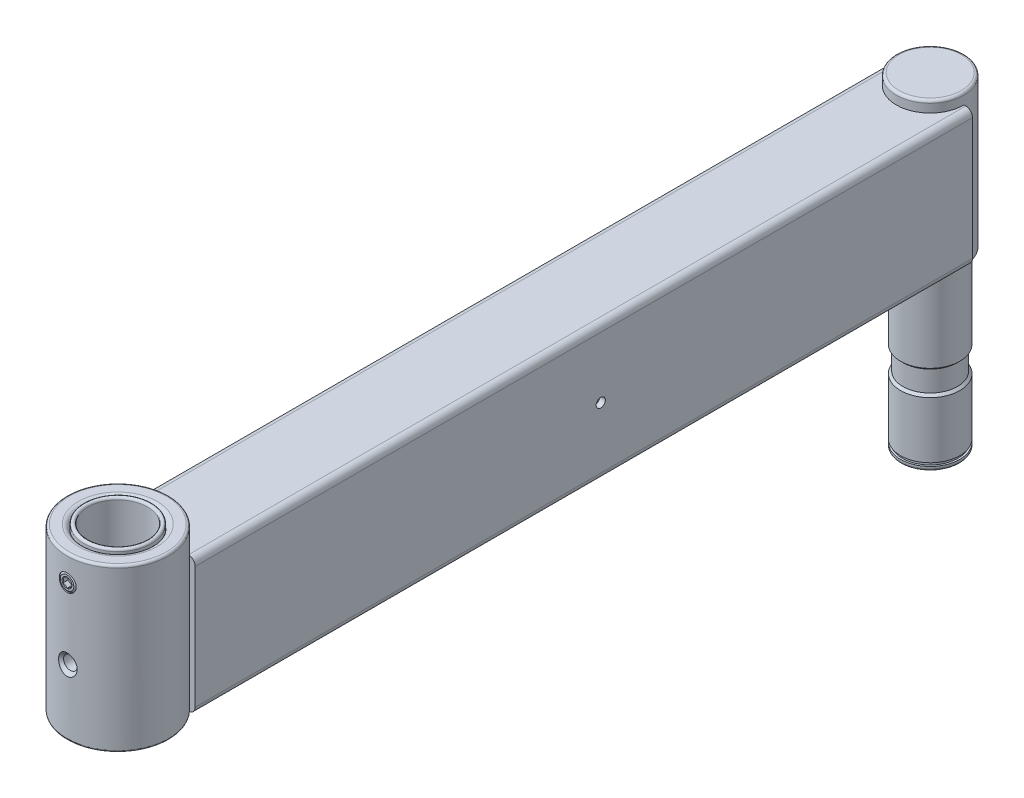
from build123d import *

# Parameters (mm, degrees)
BOSS_EXTRUDE1_DEPTH = 291.6428
SKETCH3_R           = 19.05
CUT_EXTRUDE1_DEPTH  = 300.588207448
CUT_EXTRUDE2_REACH  = 301.588
SKETCH4_R           = 3.175
SKETCH7_W           = 19.05
SKETCH7_H           = 3.175
CUT_EXTRUDE3_DEPTH  = 1.905
SKETCH11_R          = 1.7272
CUT_EXTRUDE4_DEPTH  = 2.1082
SKETCH12_R          = 1.7272
CUT_EXTRUDE5_DEPTH  = 2.1082


with BuildPart() as part:
    # Sketch1 → Revolve1 (revolve)
    with BuildSketch(Plane.XY, mode=Mode.PRIVATE) as revolve1_sk:
        with BuildLine():
            Line((0, -60.833), (-10.34034, -60.833))
            ThreePointArc((-10.34034, -60.833), (-10.879155367, -60.609815367), (-11.10234, -60.071))
            Line((-11.10234, -60.071), (-11.10234, -59.309))
            Line((-11.10234, -59.309), (-10.42924, -59.309))
            Line((-10.42924, -59.309), (-10.42924, -58.1152))
            Line((-10.42924, -58.1152), (-11.10234, -58.1152))
            Line((-11.10234, -58.1152), (-11.10234, -36.957))
            Line((-11.10234, -36.957), (-10.22604, -36.0807))
            Line((-10.22604, -36.0807), (-10.22604, -28.3083))
            Line((-10.22604, -28.3083), (-11.10234, -27.432))
            Line((-11.10234, -27.432), (-11.10234, 4.318))
            Line((-11.10234, 4.318), (-12.7, 4.318))
            Line((-12.7, 4.318), (-12.7, 59.817))
            ThreePointArc((-12.7, 59.817), (-12.40242049, 60.53542049), (-11.684, 60.833))
            Line((-11.684, 60.833), (0, 60.833))
            Line((0, 60.833), (0, -60.833))
        make_face()
    revolve(revolve1_sk.sketch.rotate(Axis((0, -60.833, 0), (0, 1, 0)), 270), axis=Axis((0, -60.833, 0), (0, 1, 0)))

    # Sketch2 → Boss-Extrude1 (add)
    with BuildSketch(Plane.XY):
        with BuildLine():
            Line((-15.875, 54.102), (-15.875, 8.382))
            ThreePointArc((-15.875, 8.382), (-15.131051224, 6.585948776), (-13.335, 5.842))
            Line((-13.335, 5.842), (13.335, 5.842))
            ThreePointArc((13.335, 5.842), (15.131051224, 6.585948776), (15.875, 8.382))
            Line((15.875, 8.382), (15.875, 54.102))
            ThreePointArc((15.875, 54.102), (15.131051224, 55.898051224), (13.335, 56.642))
            Line((13.335, 56.642), (-13.335, 56.642))
            ThreePointArc((-13.335, 56.642), (-15.131051224, 55.898051224), (-15.875, 54.102))
        make_face()
        with BuildLine():
            Line((-13.335, 54.5338), (13.335, 54.5338))
            ThreePointArc((13.335, 54.5338), (13.640328708, 54.407328708), (13.7668, 54.102))
            Line((13.7668, 54.102), (13.7668, 8.382))
            ThreePointArc((13.7668, 8.382), (13.640328708, 8.076671292), (13.335, 7.9502))
            Line((13.335, 7.9502), (-13.335, 7.9502))
            ThreePointArc((-13.335, 7.9502), (-13.640328708, 8.076671292), (-13.7668, 8.382))
            Line((-13.7668, 8.382), (-13.7668, 54.102))
            ThreePointArc((-13.7668, 54.102), (-13.640328708, 54.407328708), (-13.335, 54.5338))
        make_face(mode=Mode.SUBTRACT)
    extrude(amount=BOSS_EXTRUDE1_DEPTH)

    # Sketch3 → Cut-Extrude1 (cut, through all)
    with BuildSketch(Plane.XZ.offset(-5.842)):
        with Locations((0, 304.8)):
            Circle(SKETCH3_R)
    extrude(amount=-CUT_EXTRUDE1_DEPTH, mode=Mode.SUBTRACT)

    # Sketch4 → Cut-Extrude2 (cut, up to next)
    with BuildSketch(Plane.XZ.offset(-5.842), mode=Mode.PRIVATE) as cut_extrude2_sk1:
        with Locations(Location((0, 20.32, 0), (0, 0, 270))):
            Circle(SKETCH4_R)
    cut_extrude2_tool1 = extrude(cut_extrude2_sk1.sketch, amount=-CUT_EXTRUDE2_REACH, mode=Mode.PRIVATE) & part.part
    # Sketch4 → Cut-Extrude2 (cut, up to next)
    with BuildSketch(Plane.XZ.offset(-5.842), mode=Mode.PRIVATE) as cut_extrude2_sk2:
        with Locations(Location((0, 278.13, 0), (0, 0, 270))):
            Circle(SKETCH4_R)
    cut_extrude2_tool2 = extrude(cut_extrude2_sk2.sketch, amount=-CUT_EXTRUDE2_REACH, mode=Mode.PRIVATE) & part.part
    add(cut_extrude2_tool1.solids().sort_by_distance((0, 5.842, 20.32))[0], mode=Mode.SUBTRACT)
    add(cut_extrude2_tool2.solids().sort_by_distance((0, 5.842, 278.13))[0], mode=Mode.SUBTRACT)

    # Sketch5 → Revolve2 (revolve)
    with BuildSketch(Plane(origin=(0, 0, 0), x_dir=(0, 0, -1), z_dir=(1, 0, 0))):
        with BuildLine():
            Line((-285.75, 6.35), (-285.75, 65.659))
            ThreePointArc((-285.75, 65.659), (-286.010382072, 66.287617928), (-286.639, 66.548))
            Line((-286.639, 66.548), (-290.068, 66.548))
            ThreePointArc((-290.068, 66.548), (-291.504840979, 65.952840979), (-292.1, 64.516))
            Line((-292.1, 64.516), (-292.1, 6.477))
            Line((-292.1, 6.477), (-291.465, 5.842))
            Line((-291.465, 5.842), (-286.258, 5.842))
            ThreePointArc((-286.258, 5.842), (-285.898789755, 5.990789755), (-285.75, 6.35))
        make_face()
    revolve(axis=Axis((0, 5.842, 304.8), (0, 1, 0)))

    # Sketch7 → Cut-Revolve1 (revolve, cut)
    with BuildSketch(Plane(origin=(0, 0, 0), x_dir=(0, 0, -1), z_dir=(1, 0, 0)), mode=Mode.PRIVATE) as cut_revolve1_sk:
        with Locations((-314.325, 58.6105)):
            Rectangle(SKETCH7_W, SKETCH7_H)
    revolve(cut_revolve1_sk.sketch.rotate(Axis((0, 57.023, 304.8), (0, 0, 1)), 90), axis=Axis((0, 57.023, 304.8), (0, 0, 1)), mode=Mode.SUBTRACT)

    # Sketch10 → Cut-Revolve2 (revolve, cut)
    with BuildSketch(Plane(origin=(0, 0, 0), x_dir=(0, 0, -1), z_dir=(1, 0, 0)), mode=Mode.PRIVATE) as cut_revolve2_sk:
        Polygon((-323.85, 30.4038), (-304.8, 30.4038), (-304.8, 32.9565), (-322.5927, 32.9565), (-323.85, 34.2138), align=None)
    revolve(cut_revolve2_sk.sketch.rotate(Axis((0, 30.4038, 323.85), (0, 0, -1)), 90), axis=Axis((0, 30.4038, 323.85), (0, 0, -1)), mode=Mode.SUBTRACT)

    # Sketch11 → Cut-Extrude4 (cut)
    with BuildSketch(Plane(origin=(15.875, 0, 0), x_dir=(0, 0, -1), z_dir=(1, 0, 0))):
        with Locations(Location((-139.4714, 31.242, 0), (0, 0, 90))):
            Circle(SKETCH11_R)
    extrude(amount=-CUT_EXTRUDE4_DEPTH, mode=Mode.SUBTRACT)

    # Sketch12 → Cut-Extrude5 (cut)
    with BuildSketch(Plane.ZY.offset(15.875)):
        with Locations(Location((152.1714, 31.242, 0), (0, 0, 270))):
            Circle(SKETCH12_R)
    extrude(amount=-CUT_EXTRUDE5_DEPTH, mode=Mode.SUBTRACT)


with BuildPart() as body_2:
    # Sketch6 → Revolve3 (revolve)
    with BuildSketch(Plane(origin=(0, 0, 0), x_dir=(0, 0, -1), z_dir=(1, 0, 0)), mode=Mode.PRIVATE) as revolve3_sk:
        with BuildLine():
            Line((-292.1, 36.3855), (-292.1, 66.548))
            ThreePointArc((-292.1, 66.548), (-292.89375, 67.34175), (-293.6875, 66.548))
            Line((-293.6875, 66.548), (-293.6875, 36.3855))
            ThreePointArc((-293.6875, 36.3855), (-292.89375, 35.59175), (-292.1, 36.3855))
        make_face()
        with BuildLine():
            Line((-292.1, 24.09825), (-292.1, 6.63575))
            ThreePointArc((-292.1, 6.63575), (-292.89375, 5.842), (-293.6875, 6.63575))
            Line((-293.6875, 6.63575), (-293.6875, 24.09825))
            ThreePointArc((-293.6875, 24.09825), (-292.89375, 24.892), (-292.1, 24.09825))
        make_face()
    revolve(revolve3_sk.sketch.rotate(Axis((0, 66.548, 304.8), (0, -1, 0)), 180), axis=Axis((0, 66.548, 304.8), (0, -1, 0)))


with BuildPart() as body_3:
    # Sketch8 → Revolve5 (revolve)
    with BuildSketch(Plane(origin=(0, 0, 0), x_dir=(0, 0, -1), z_dir=(1, 0, 0)), mode=Mode.PRIVATE) as revolve5_sk:
        Polygon((-323.85, 59.563), (-323.405368213, 60.198), (-318.9351, 60.198), (-317.5, 58.7629), (-317.5, 57.023), (-321.945, 57.023), (-321.945, 58.6105), (-323.60489, 58.6105), (-323.85, 58.85561), align=None)
    revolve(revolve5_sk.sketch.rotate(Axis((0, 57.023, 321.945), (0, 0, 1)), 90), axis=Axis((0, 57.023, 321.945), (0, 0, 1)))

    # Sketch9 → Cut-Extrude3 (cut)
    with BuildSketch(Plane.XY.offset(323.85)):
        Polygon((0, 58.856087105), (-1.5875, 57.939543552), (-1.5875, 56.106456448), (0, 55.189912895), (1.5875, 56.106456448), (1.5875, 57.939543552), align=None)
    extrude(amount=-CUT_EXTRUDE3_DEPTH, mode=Mode.SUBTRACT)


solid = Compound([part.part, body_2.part, body_3.part])
